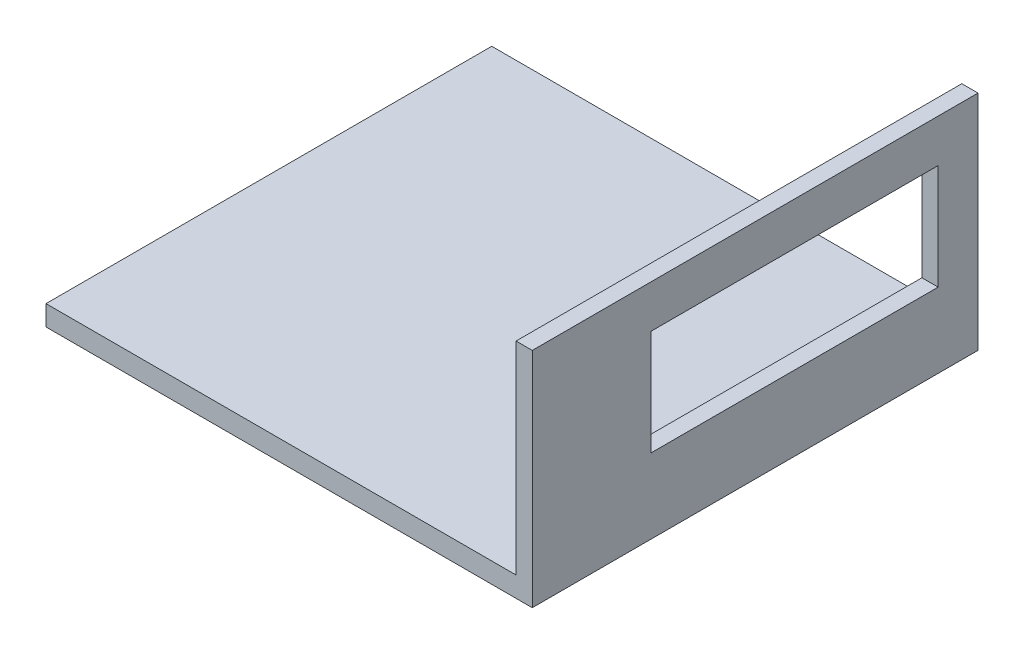
from build123d import *

# Parameters (mm, degrees)
SKETCH1_W           = 120
SKETCH1_H           = 110
BOSS_EXTRUDE1_DEPTH = 5
SKETCH2_W           = 4
SKETCH2_H           = 110
BOSS_EXTRUDE2_DEPTH = 50
CUT_EXTRUDE1_REACH  = 145.003
SKETCH3_W           = 70.920113649
SKETCH3_H           = 25.988088709


with BuildPart() as part:
    # Sketch1 → Boss-Extrude1 (new body)
    with BuildSketch(Plane(origin=(0, 0, 0), x_dir=(1, 0, 0), z_dir=(0, 1, 0))):
        Rectangle(SKETCH1_W, SKETCH1_H)
    extrude(amount=BOSS_EXTRUDE1_DEPTH)

    # Sketch2 → Boss-Extrude2 (add)
    with BuildSketch(Plane(origin=(0, 5, 0), x_dir=(1, 0, 0), z_dir=(0, 1, 0))):
        with Locations((58, 0)):
            Rectangle(SKETCH2_W, SKETCH2_H)
    extrude(amount=BOSS_EXTRUDE2_DEPTH)

    # Sketch3 → Cut-Extrude1 (cut, up to next)
    with BuildSketch(Plane(origin=(60, 0, 0), x_dir=(0, 0, -1), z_dir=(1, 0, 0)), mode=Mode.PRIVATE) as cut_extrude1_sk1:
        with Locations((9.701412532, 31.435505385)):
            Rectangle(SKETCH3_W, SKETCH3_H)
    cut_extrude1_tool1 = extrude(cut_extrude1_sk1.sketch, amount=-CUT_EXTRUDE1_REACH, mode=Mode.PRIVATE) & part.part
    add(cut_extrude1_tool1.solids().sort_by_distance((60, 31.435505, -9.701413))[0], mode=Mode.SUBTRACT)


solid = part.part
